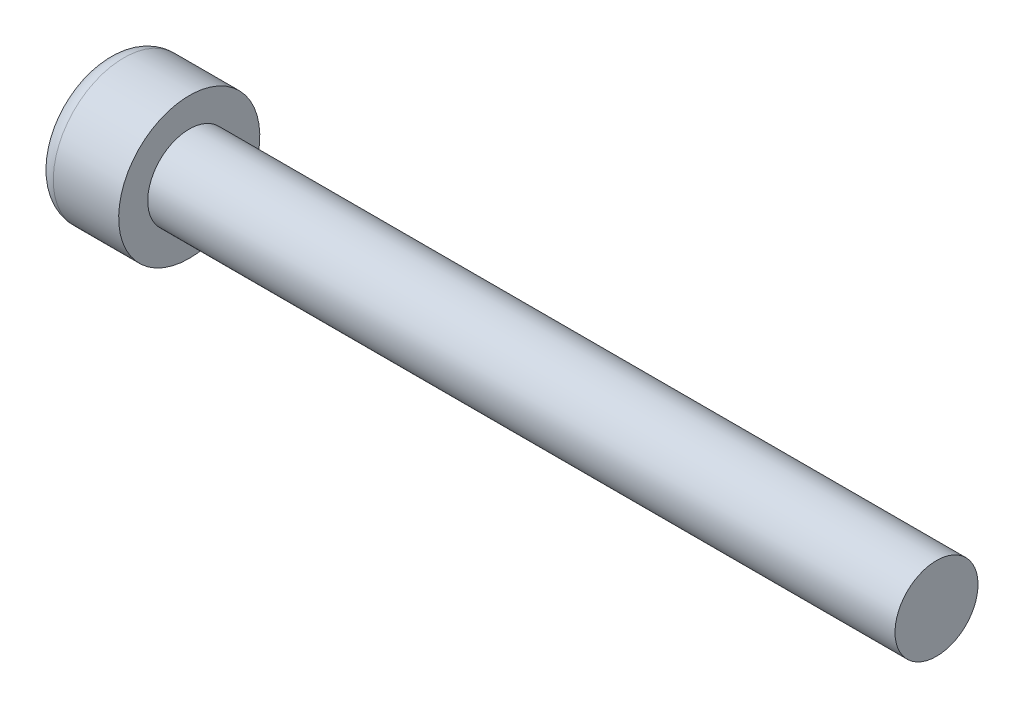
from build123d import *

# Parameters (mm, degrees)
CUT_EXTRUDE1_DEPTH = 2.5


with BuildPart() as part:
    # Sketch1 → Revolve1 (revolve)
    with BuildSketch(Plane.XY, mode=Mode.PRIVATE) as revolve1_sk:
        with BuildLine():
            Line((0, 0), (0, 3.1875))
            ThreePointArc((0, 3.1875), (0.311199045, 3.938800955), (1.0625, 4.25))
            Line((1.0625, 4.25), (5, 4.25))
            Line((5, 4.25), (5, 2.5))
            Line((5, 2.5), (50, 2.5))
            Line((50, 2.5), (50, 0))
            Line((50, 0), (0, 0))
        make_face()
    revolve(revolve1_sk.sketch.rotate(Axis((0, 0, 0), (1, 0, 0)), 180), axis=Axis((0, 0, 0), (1, 0, 0)))

    # Sketch2 → Cut-Extrude1 (cut)
    with BuildSketch(Plane.ZY):
        Polygon((0, 2.309401077), (-2, 1.154700538), (-2, -1.154700538), (0, -2.309401077), (2, -1.154700538), (2, 1.154700538), align=None)
    extrude(amount=-CUT_EXTRUDE1_DEPTH, mode=Mode.SUBTRACT)


solid = part.part
